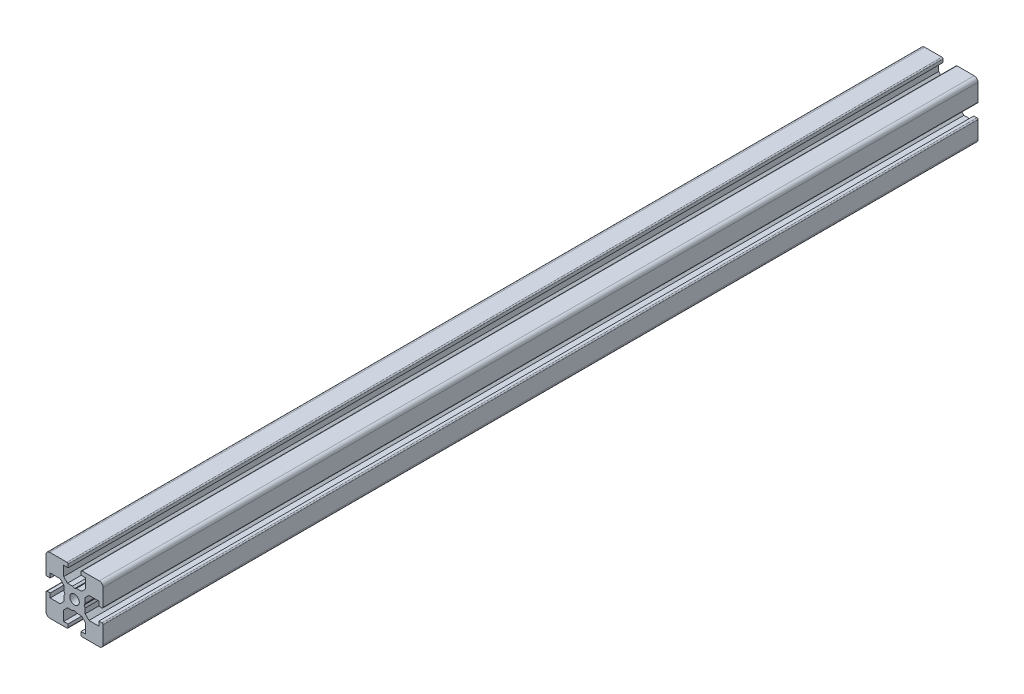
from build123d import *

# Parameters (mm, degrees)
SKETCH1_R           = 1.25
BOSS_EXTRUDE1_DEPTH = 230


with BuildPart() as part:
    # Sketch1 → Boss-Extrude1 (new body)
    with BuildSketch(Plane.XY.offset(300)):
        with BuildLine():
            Line((-7.5, 6.5), (-7.5, 2))
            ThreePointArc((-7.5, 2), (-7.412132034, 1.787867966), (-7.2, 1.7))
            Line((-7.2, 1.7), (-6.4, 1.7))
            Line((-6.4, 1.7), (-6.4, 2.85))
            Line((-6.4, 2.85), (-3.8, 2.85))
            Line((-3.8, 2.85), (-2.8, 1.85))
            Line((-2.8, 1.85), (-2.8, 0.519615242))
            Line((-2.8, 0.519615242), (-2.5, 0))
            Line((-2.5, 0), (-2.8, -0.519615242))
            Line((-2.8, -0.519615242), (-2.8, -1.85))
            Line((-2.8, -1.85), (-3.8, -2.85))
            Line((-3.8, -2.85), (-6.4, -2.85))
            Line((-6.4, -2.85), (-6.4, -1.7))
            Line((-6.4, -1.7), (-7.2, -1.7))
            ThreePointArc((-7.2, -1.7), (-7.412132034, -1.787867966), (-7.5, -2))
            Line((-7.5, -2), (-7.5, -6.5))
            ThreePointArc((-7.5, -6.5), (-7.207106781, -7.207106781), (-6.5, -7.5))
            Line((-6.5, -7.5), (-2, -7.5))
            ThreePointArc((-2, -7.5), (-1.787867966, -7.412132034), (-1.7, -7.2))
            Line((-1.7, -7.2), (-1.7, -6.4))
            Line((-1.7, -6.4), (-2.85, -6.4))
            Line((-2.85, -6.4), (-2.85, -3.8))
            Line((-2.85, -3.8), (-1.85, -2.8))
            Line((-1.85, -2.8), (-0.519615242, -2.8))
            Line((-0.519615242, -2.8), (0, -2.5))
            Line((0, -2.5), (0.519615242, -2.8))
            Line((0.519615242, -2.8), (1.85, -2.8))
            Line((1.85, -2.8), (2.85, -3.8))
            Line((2.85, -3.8), (2.85, -6.4))
            Line((2.85, -6.4), (1.7, -6.4))
            Line((1.7, -6.4), (1.7, -7.2))
            ThreePointArc((1.7, -7.2), (1.787867966, -7.412132034), (2, -7.5))
            Line((2, -7.5), (6.5, -7.5))
            ThreePointArc((6.5, -7.5), (7.207106781, -7.207106781), (7.5, -6.5))
            Line((7.5, -6.5), (7.5, -2))
            ThreePointArc((7.5, -2), (7.412132034, -1.787867966), (7.2, -1.7))
            Line((7.2, -1.7), (6.4, -1.7))
            Line((6.4, -1.7), (6.4, -2.85))
            Line((6.4, -2.85), (3.8, -2.85))
            Line((3.8, -2.85), (2.8, -1.85))
            Line((2.8, -1.85), (2.8, -0.519615242))
            Line((2.8, -0.519615242), (2.5, 0))
            Line((2.5, 0), (2.8, 0.519615242))
            Line((2.8, 0.519615242), (2.8, 1.85))
            Line((2.8, 1.85), (3.8, 2.85))
            Line((3.8, 2.85), (6.4, 2.85))
            Line((6.4, 2.85), (6.4, 1.7))
            Line((6.4, 1.7), (7.2, 1.7))
            ThreePointArc((7.2, 1.7), (7.412132034, 1.787867966), (7.5, 2))
            Line((7.5, 2), (7.5, 6.5))
            ThreePointArc((7.5, 6.5), (7.207106781, 7.207106781), (6.5, 7.5))
            Line((6.5, 7.5), (2, 7.5))
            ThreePointArc((2, 7.5), (1.787867966, 7.412132034), (1.7, 7.2))
            Line((1.7, 7.2), (1.7, 6.4))
            Line((1.7, 6.4), (2.85, 6.4))
            Line((2.85, 6.4), (2.85, 3.8))
            Line((2.85, 3.8), (1.85, 2.8))
            Line((1.85, 2.8), (0.519615242, 2.8))
            Line((0.519615242, 2.8), (0, 2.5))
            Line((0, 2.5), (-0.519615242, 2.8))
            Line((-0.519615242, 2.8), (-1.85, 2.8))
            Line((-1.85, 2.8), (-2.85, 3.8))
            Line((-2.85, 3.8), (-2.85, 6.4))
            Line((-2.85, 6.4), (-1.7, 6.4))
            Line((-1.7, 6.4), (-1.7, 7.2))
            ThreePointArc((-1.7, 7.2), (-1.787867966, 7.412132034), (-2, 7.5))
            Line((-2, 7.5), (-6.5, 7.5))
            ThreePointArc((-6.5, 7.5), (-7.207106781, 7.207106781), (-7.5, 6.5))
        make_face()
        with Locations(Location((0, 0, 0), (0, 0, 180))):
            Circle(SKETCH1_R, mode=Mode.SUBTRACT)
    extrude(amount=-BOSS_EXTRUDE1_DEPTH)


solid = part.part
